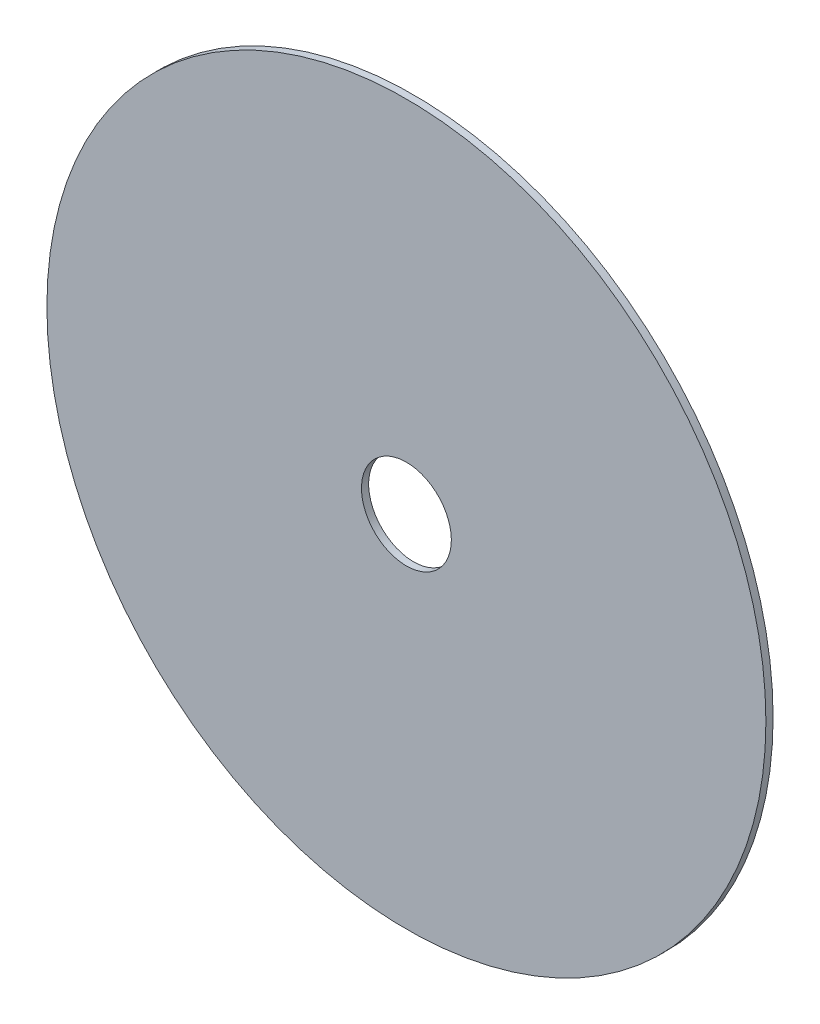
from build123d import *

# Parameters (mm, degrees)
ESQUISSE1_R        = 60
ESQUISSE1_R_2      = 7.5
BOSS_EXTRU_1_DEPTH = 1.2


with BuildPart() as part:
    # Esquisse1 → Boss.-Extru.1 (new body)
    with BuildSketch(Plane.XY):
        Circle(ESQUISSE1_R)
        Circle(ESQUISSE1_R_2, mode=Mode.SUBTRACT)
    extrude(amount=BOSS_EXTRU_1_DEPTH)


solid = part.part
